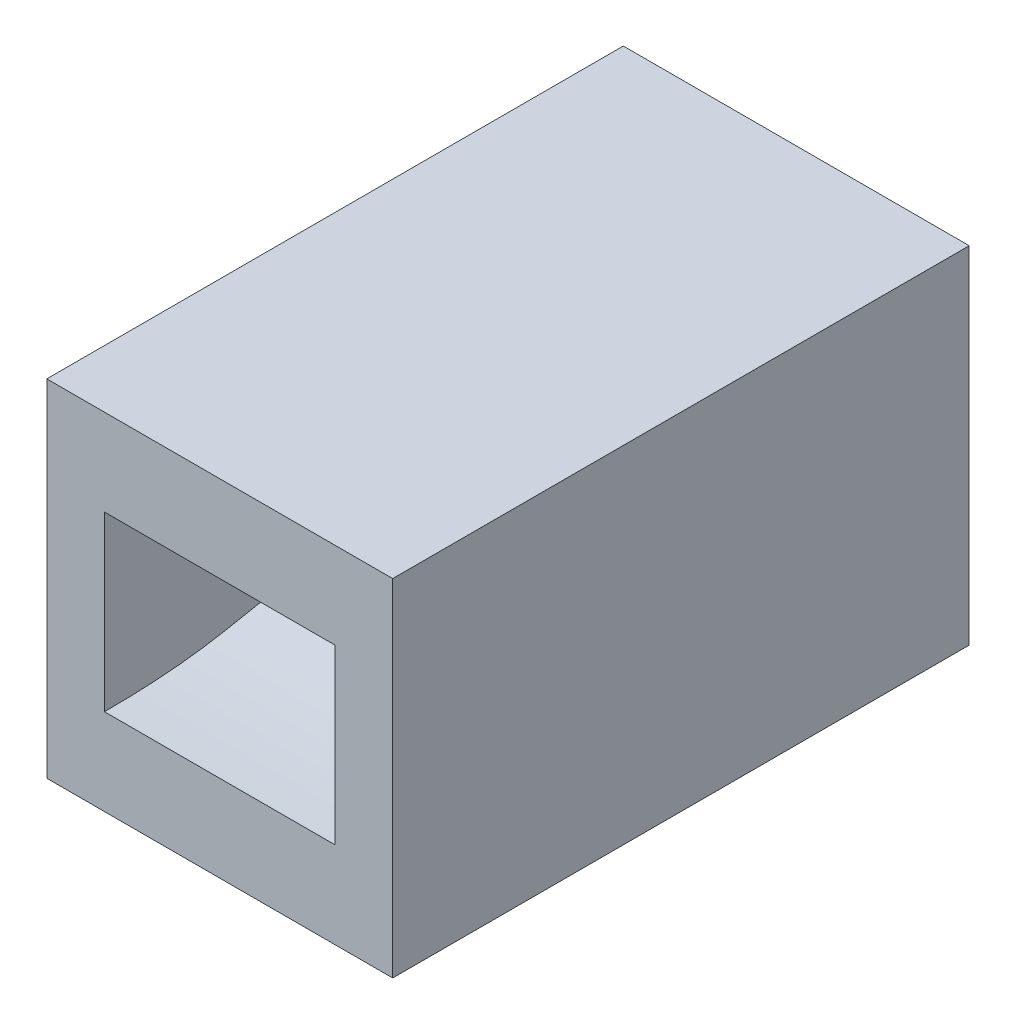
from build123d import *

# Parameters (mm, degrees)
SKETCH1_W           = 100
SKETCH1_H           = 60
BOSS_EXTRUDE1_DEPTH = 30
CUT_EXTRUDE1_DEPTH  = 20


with BuildPart() as part:
    # Sketch1 → Boss-Extrude1 (new, symmetric)
    with BuildSketch(Plane(origin=(0, 0, 0), x_dir=(0, 0, -1), z_dir=(1, 0, 0))):
        with Locations((-50, 0)):
            Rectangle(SKETCH1_W, SKETCH1_H)
    extrude(amount=BOSS_EXTRUDE1_DEPTH, both=True)

    # Sketch2 → Cut-Extrude1 (cut, symmetric)
    with BuildSketch(Plane(origin=(0, 0, 0), x_dir=(0, 0, -1), z_dir=(1, 0, 0))):
        with BuildLine():
            Line((0, 15), (0, -15))
            add(Edge.make_bspline(
                [(0, -15), (-25, -15), (-25, -10), (-50, -10)],
                knots=[0, 0, 0, 0, 1, 1, 1, 1], degree=3))
            Line((-50, -10), (-50, 20))
            add(Edge.make_bspline(
                [(0, 15), (-25, 15), (-25, 20), (-50, 20)],
                knots=[0, 0, 0, 0, 1, 1, 1, 1], degree=3))
        make_face()
    cut_extrude1 = extrude(amount=CUT_EXTRUDE1_DEPTH, both=True, mode=Mode.SUBTRACT)

    # Mirror1: Cut-Extrude1 across plane
    add(cut_extrude1.mirror(Plane(origin=(-20, 20, 50), x_dir=(1, 0, 0), z_dir=(0, 0, 1))), mode=Mode.SUBTRACT)


solid = part.part
